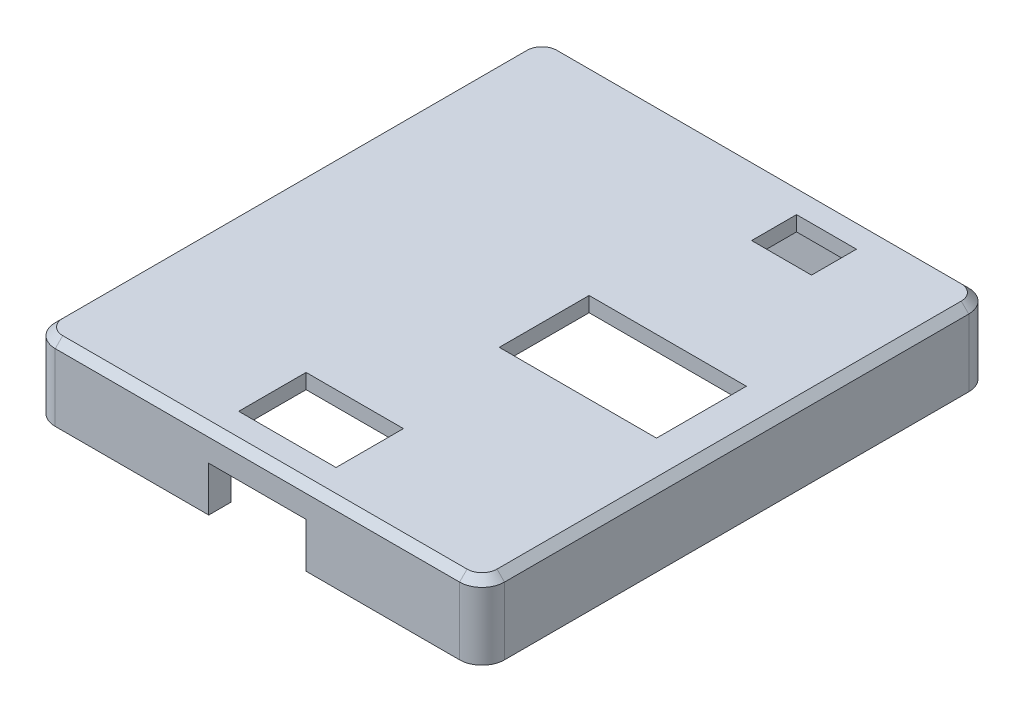
from build123d import *

# Parameters (mm, degrees)
SKETCH1_W                   = 76.2
SKETCH1_H                   = 86.36
BOSS_EXTRUDE1_DEPTH         = 12.7
FILLET1_R                   = 3.81
CHAMFER1_SIZE               = 1.27
CUT_EXTRUDE1_DEPTH          = 10.16
SKETCH5_W                   = 16.51
SKETCH5_H                   = 11.43
CUT_EXTRUDE2_DEPTH          = 2.54
CUT_EXTRUDE3_REACH          = 117.87
SKETCH6_W                   = 16.51
SKETCH6_H                   = 7.62
CUT_EXTRUDE4_REACH          = 117.87
SKETCH8_W                   = 8.128
SKETCH8_H                   = 1.27
CUT_EXTRUDE5_REACH          = 117.87
SKETCH9_W                   = 10.16
SKETCH9_H                   = 3.81
CUT_EXTRUDE6_REACH          = 117.87
SKETCH10_W                  = 10.16
SKETCH10_H                  = 7.62
CUT_EXTRUDE7_REACH          = 117.87
SKETCH11_W                  = 26.67
SKETCH11_H                  = 15.24
F_1_4_20_TAPPED_HOLE1_D     = 5.1054
F_1_4_20_TAPPED_HOLE1_DEPTH = 6.35
F_1_4_20_TAPPED_HOLE1_TIP   = 1.533816902


with BuildPart() as part:
    # Sketch1 → Boss-Extrude1 (new body)
    with BuildSketch(Plane(origin=(0, 0, 0), x_dir=(1, 0, 0), z_dir=(0, 1, 0))):
        with Locations((38.1, 43.18)):
            Rectangle(SKETCH1_W, SKETCH1_H)
    extrude(amount=BOSS_EXTRUDE1_DEPTH)

    # Fillet1
    fillet1_edges = [part.edges().sort_by_distance(p)[0] for p in [
        (0, 6.35, -86.36),
        (76.2, 6.35, -86.36),
        (76.2, 6.35, 0),
        (0, 6.35, 0),
    ]]
    fillet(fillet1_edges, radius=FILLET1_R)

    # Chamfer1
    chamfer1_edges = [part.edges().sort_by_distance(p)[0] for p in [
        (0, 12.7, -43.18),
        (38.1, 12.7, -86.36),
        (38.1, 12.7, 0),
        (76.2, 12.7, -43.18),
        (1.115923164, 12.7, -1.115923164),
        (75.084076836, 12.7, -1.115923164),
        (75.084076836, 12.7, -85.244076836),
        (1.115923164, 12.7, -85.244076836),
    ]]
    chamfer(chamfer1_edges, length=CHAMFER1_SIZE)

    # Sketch4 → Cut-Extrude1 (cut)
    with BuildSketch(Plane.XZ):
        Polygon((3.81, -16.51), (16.51, -16.51), (16.51, -3.81), (59.69, -3.81), (59.69, -16.51), (72.39, -16.51), (72.39, -69.85), (59.69, -69.85), (59.69, -82.55), (16.51, -82.55), (16.51, -69.85), (3.81, -69.85), align=None)
    extrude(amount=-CUT_EXTRUDE1_DEPTH, mode=Mode.SUBTRACT)

    # Sketch5 → Cut-Extrude2 (cut)
    with BuildSketch(Plane(origin=(0, 12.7, 0), x_dir=(1, 0, 0), z_dir=(0, 1, 0))):
        with Locations((38.1, 10.795)):
            Rectangle(SKETCH5_W, SKETCH5_H)
    extrude(amount=-CUT_EXTRUDE2_DEPTH, mode=Mode.SUBTRACT)

    # Sketch6 → Cut-Extrude3 (cut, up to next)
    with BuildSketch(Plane.XY, mode=Mode.PRIVATE) as cut_extrude3_sk1:
        with Locations((38.1, 3.81)):
            Rectangle(SKETCH6_W, SKETCH6_H)
    cut_extrude3_tool1 = extrude(cut_extrude3_sk1.sketch, amount=-CUT_EXTRUDE3_REACH, mode=Mode.PRIVATE) & part.part
    add(cut_extrude3_tool1.solids().sort_by_distance((38.1, 3.81, 0))[0], mode=Mode.SUBTRACT)

    # Sketch8 → Cut-Extrude4 (cut, up to next)
    with BuildSketch(Plane(origin=(0, 0, -86.36), x_dir=(-1, 0, 0), z_dir=(0, 0, -1)), mode=Mode.PRIVATE) as cut_extrude4_sk1:
        with Locations((-38.1, 0.635)):
            Rectangle(SKETCH8_W, SKETCH8_H)
    cut_extrude4_tool1 = extrude(cut_extrude4_sk1.sketch, amount=-CUT_EXTRUDE4_REACH, mode=Mode.PRIVATE) & part.part
    add(cut_extrude4_tool1.solids().sort_by_distance((38.1, 0.635, -86.36))[0], mode=Mode.SUBTRACT)

    # Sketch9 → Cut-Extrude5 (cut, up to next)
    with BuildSketch(Plane(origin=(0, 0, -86.36), x_dir=(-1, 0, 0), z_dir=(0, 0, -1)), mode=Mode.PRIVATE) as cut_extrude5_sk1:
        with Locations((-53.34, 1.905)):
            Rectangle(SKETCH9_W, SKETCH9_H)
    cut_extrude5_tool1 = extrude(cut_extrude5_sk1.sketch, amount=-CUT_EXTRUDE5_REACH, mode=Mode.PRIVATE) & part.part
    add(cut_extrude5_tool1.solids().sort_by_distance((53.34, 1.905, -86.36))[0], mode=Mode.SUBTRACT)

    # Sketch10 → Cut-Extrude6 (cut, up to next)
    with BuildSketch(Plane(origin=(0, 12.7, 0), x_dir=(1, 0, 0), z_dir=(0, 1, 0)), mode=Mode.PRIVATE) as cut_extrude6_sk1:
        with Locations((53.34, 77.47)):
            Rectangle(SKETCH10_W, SKETCH10_H)
    cut_extrude6_tool1 = extrude(cut_extrude6_sk1.sketch, amount=-CUT_EXTRUDE6_REACH, mode=Mode.PRIVATE) & part.part
    add(cut_extrude6_tool1.solids().sort_by_distance((53.34, 12.7, -77.47))[0], mode=Mode.SUBTRACT)

    # Sketch11 → Cut-Extrude7 (cut, up to next)
    with BuildSketch(Plane(origin=(0, 12.7, 0), x_dir=(1, 0, 0), z_dir=(0, 1, 0)), mode=Mode.PRIVATE) as cut_extrude7_sk1:
        with Locations((55.88, 44.196)):
            Rectangle(SKETCH11_W, SKETCH11_H)
    cut_extrude7_tool1 = extrude(cut_extrude7_sk1.sketch, amount=-CUT_EXTRUDE7_REACH, mode=Mode.PRIVATE) & part.part
    add(cut_extrude7_tool1.solids().sort_by_distance((55.88, 12.7, -44.196))[0], mode=Mode.SUBTRACT)

    # 1/4-20 Tapped Hole1
    with Locations(Plane(origin=(10.16, 0, -10.16), x_dir=(0, 0, -1), z_dir=(0, -1, 0))):
        with Locations((0, 0), (66.04, 0), (66.04, 55.88), (0, 55.88)):
            Hole(F_1_4_20_TAPPED_HOLE1_D / 2, depth=F_1_4_20_TAPPED_HOLE1_DEPTH)
            with Locations((0, 0, -(F_1_4_20_TAPPED_HOLE1_DEPTH + F_1_4_20_TAPPED_HOLE1_TIP / 2))):  # 118° drill point
                Cone(0, F_1_4_20_TAPPED_HOLE1_D / 2, F_1_4_20_TAPPED_HOLE1_TIP, mode=Mode.SUBTRACT)


solid = part.part
